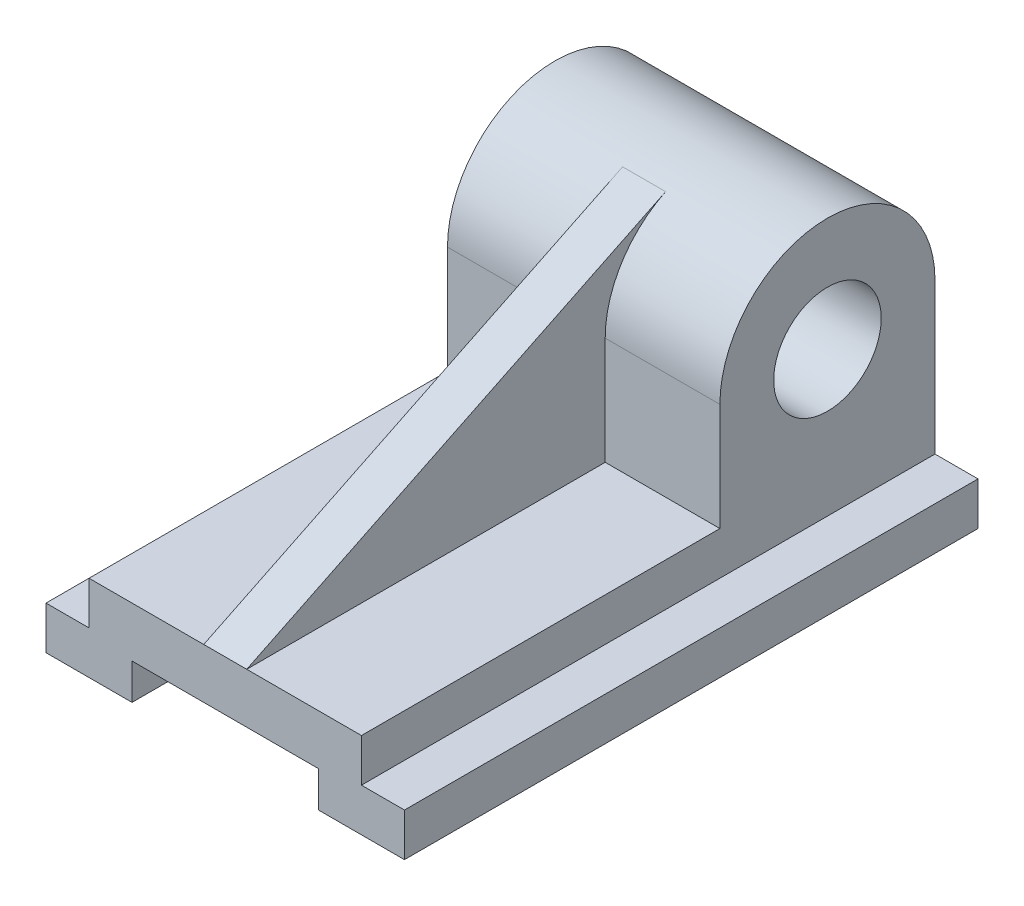
from build123d import *

# Parameters (mm, degrees)
SKETCH3_W           = 100
SKETCH3_H           = 24
BOSS_EXTRUDE4_DEPTH = 160
SKETCH4_W           = 52
SKETCH4_H           = 10
SKETCH4_W_2         = 12
SKETCH4_H_2         = 12
CUT_EXTRUDE6_DEPTH  = 169.059513268
SKETCH6_W           = 76
SKETCH6_H           = 60
BOSS_EXTRUDE6_DEPTH = 60
FILLET1_RADIUS      = 30
FILLET1_LENGTH      = 76
SKETCH7_R           = 15
CUT_EXTRUDE7_DEPTH  = 197.285506342
RIB4_REACH          = 184.439
SKETCH10_WALL_W     = 496.878018
SKETCH10_WALL_H     = 12


with BuildPart() as part:
    # Sketch3 → Boss-Extrude4 (new body)
    with BuildSketch(Plane.XY):
        Rectangle(SKETCH3_W, SKETCH3_H)
    extrude(amount=BOSS_EXTRUDE4_DEPTH)

    # Sketch4 → Cut-Extrude6 (cut, through all)
    with BuildSketch(Plane.XY.offset(160)):
        with Locations((0, -7)):
            Rectangle(SKETCH4_W, SKETCH4_H)
        with Locations((-44, 6)):
            Rectangle(SKETCH4_W_2, SKETCH4_H_2)
        with Locations((44, 6)):
            Rectangle(SKETCH4_W_2, SKETCH4_H_2)
    extrude(amount=-CUT_EXTRUDE6_DEPTH, mode=Mode.SUBTRACT)

    # Sketch6 → Boss-Extrude6 (add)
    with BuildSketch(Plane(origin=(0, 12, 0), x_dir=(1, 0, 0), z_dir=(0, 1, 0))):
        with Locations((0, -30)):
            Rectangle(SKETCH6_W, SKETCH6_H)
    extrude(amount=BOSS_EXTRUDE6_DEPTH)

    # Fillet1: full round fillet: the end face becomes a half cylinder, R = half its width
    fillet1_face = Plane((0, 72, 30), x_dir=(1, 0, 0), z_dir=(0, 1, 0))  # on the end face: x along it, z out of the body
    fillet1_slab = fillet1_face.offset(-FILLET1_RADIUS / 2) * Box(FILLET1_LENGTH, 2 * FILLET1_RADIUS, FILLET1_RADIUS, mode=Mode.PRIVATE)  # the body's end, R deep
    fillet1_round = Plane((0, 42, 30), x_dir=(0, 1, 0), z_dir=(1, 0, 0)) * Cylinder(FILLET1_RADIUS, FILLET1_LENGTH, mode=Mode.PRIVATE)  # its axis R under the face
    add(fillet1_slab - fillet1_round, mode=Mode.SUBTRACT)

    # Sketch7 → Cut-Extrude7 (cut, through all)
    with BuildSketch(Plane(origin=(38, 0, 0), x_dir=(0, 0, -1), z_dir=(1, 0, 0))):
        with Locations((-30, 40.32351594)):
            Circle(SKETCH7_R)
    extrude(amount=-CUT_EXTRUDE7_DEPTH, mode=Mode.SUBTRACT)

    # Sketch10 wall → Rib4 (add, up to next)
    with BuildSketch(Plane(origin=(0, 40.483136466, 101.573053404), x_dir=(0, 0.43820224719, -0.898876404495), z_dir=(0, 0.898876404495, 0.43820224719)), mode=Mode.PRIVATE) as rib4_sk1:
        Rectangle(SKETCH10_WALL_W, SKETCH10_WALL_H)
    rib4_tool1 = extrude(rib4_sk1.sketch, amount=-RIB4_REACH, mode=Mode.PRIVATE) - part.part
    add(rib4_tool1.solids().sort_by_distance((0, 40.483136466, 101.573053404))[0])


solid = part.part
